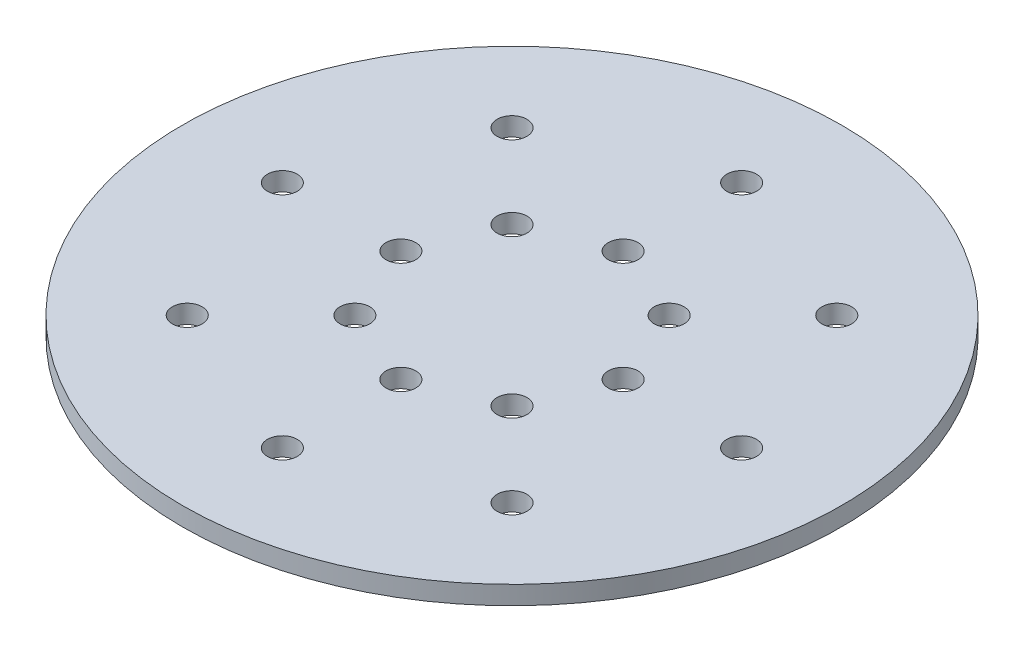
from build123d import *

# Parameters (mm, degrees)
SKETCH1_R               = 56.5
SKETCH1_R_2             = 2.5527
BOSS_EXTRUDE1_DEPTH     = 3.175
F_1_4_20_TAPPED_HOLE1_D = 5.1054


with BuildPart() as part:
    # Sketch1 → Boss-Extrude1 (new body)
    # profile 1 of 9: a face of its own
    with BuildSketch(Plane(origin=(0, 0, 0), x_dir=(1, 0, 0), z_dir=(0, 1, 0))):
        with Locations(Location((0, 0, 0), (0, 0, 270))):
            Circle(SKETCH1_R)
        with Locations((-13.470384182, 13.470384182)):
            Circle(SKETCH1_R_2, mode=Mode.SUBTRACT)
        with Locations((-19.05, 0)):
            Circle(SKETCH1_R_2, mode=Mode.SUBTRACT)
        with Locations((-13.470384182, -13.470384182)):
            Circle(SKETCH1_R_2, mode=Mode.SUBTRACT)
        with Locations((0, -19.05)):
            Circle(SKETCH1_R_2, mode=Mode.SUBTRACT)
        with Locations((13.470384182, -13.470384182)):
            Circle(SKETCH1_R_2, mode=Mode.SUBTRACT)
        with Locations((19.05, 0)):
            Circle(SKETCH1_R_2, mode=Mode.SUBTRACT)
        with Locations((13.470384182, 13.470384182)):
            Circle(SKETCH1_R_2, mode=Mode.SUBTRACT)
        with Locations((0, 19.05)):
            Circle(SKETCH1_R_2, mode=Mode.SUBTRACT)
    # profile 2 of 9: a face of its own
    with BuildSketch(Plane(origin=(0, 0, 0), x_dir=(1, 0, 0), z_dir=(0, 1, 0))):
        with Locations((13.470384182, 13.470384182)):
            Circle(SKETCH1_R_2)
    # profile 3 of 9: a face of its own
    with BuildSketch(Plane(origin=(0, 0, 0), x_dir=(1, 0, 0), z_dir=(0, 1, 0))):
        with Locations((0, 19.05)):
            Circle(SKETCH1_R_2)
    # profile 4 of 9: a face of its own
    with BuildSketch(Plane(origin=(0, 0, 0), x_dir=(1, 0, 0), z_dir=(0, 1, 0))):
        with Locations((19.05, 0)):
            Circle(SKETCH1_R_2)
    # profile 5 of 9: a face of its own
    with BuildSketch(Plane(origin=(0, 0, 0), x_dir=(1, 0, 0), z_dir=(0, 1, 0))):
        with Locations((13.470384182, -13.470384182)):
            Circle(SKETCH1_R_2)
    # profile 6 of 9: a face of its own
    with BuildSketch(Plane(origin=(0, 0, 0), x_dir=(1, 0, 0), z_dir=(0, 1, 0))):
        with Locations((0, -19.05)):
            Circle(SKETCH1_R_2)
    # profile 7 of 9: a face of its own
    with BuildSketch(Plane(origin=(0, 0, 0), x_dir=(1, 0, 0), z_dir=(0, 1, 0))):
        with Locations((-13.470384182, -13.470384182)):
            Circle(SKETCH1_R_2)
    # profile 8 of 9: a face of its own
    with BuildSketch(Plane(origin=(0, 0, 0), x_dir=(1, 0, 0), z_dir=(0, 1, 0))):
        with Locations((-13.470384182, 13.470384182)):
            Circle(SKETCH1_R_2)
    # profile 9 of 9: a face of its own
    with BuildSketch(Plane(origin=(0, 0, 0), x_dir=(1, 0, 0), z_dir=(0, 1, 0))):
        with Locations((-19.05, 0)):
            Circle(SKETCH1_R_2)
    extrude(amount=BOSS_EXTRUDE1_DEPTH)

    # 1/4-20 Tapped Hole1 (through all)
    with Locations(Plane(origin=(13.470384182, 0, -13.470384182), x_dir=(0, 0, -1), z_dir=(0, -1, 0))):
        with Locations((0, 0), (-13.470384182, 5.579615818), (-26.940768364, 0), (-32.520384182, -13.470384182), (-26.940768364, -26.940768364), (-13.470384182, -32.520384182), (0, -26.940768364), (5.579615818, -13.470384182), (25.899615818, -13.470384182), (14.368409793, -41.309178157), (-13.470384182, -52.840384182), (-41.309178157, -41.309178157), (-52.840384182, -13.470384182), (-41.309178157, 14.368409793), (-13.470384182, 25.899615818), (14.368409793, 14.368409793)):
            Hole(F_1_4_20_TAPPED_HOLE1_D / 2)


solid = part.part
